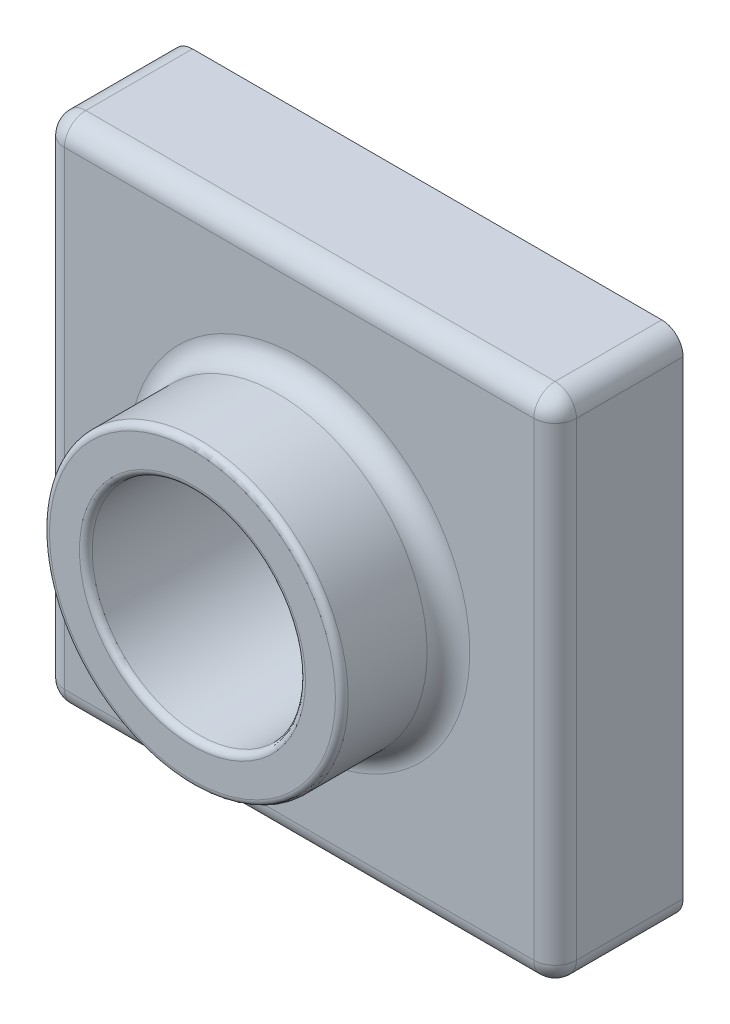
from build123d import *

# Parameters (mm, degrees)
ESQUISSE2_W             = 120
ESQUISSE2_H             = 120
BOSS_EXTRU_1_DEPTH      = 30
ESQUISSE3_R             = 35
BOSS_EXTRU_3_DEPTH      = 25
ESQUISSE9_R             = 25
ENL_V_MAT_EXTRU_1_DEPTH = 179.395627749
CONG_1_R                = 5
CONG_2_R                = 1.5
COQUE1_T                = -2


with BuildPart() as part:
    # Esquisse2 → Boss.-Extru.1 (new body)
    with BuildSketch(Plane.XY):
        with Locations((60, 60)):
            Rectangle(ESQUISSE2_W, ESQUISSE2_H)
    extrude(amount=BOSS_EXTRU_1_DEPTH)

    # Esquisse3 → Boss.-Extru.3 (add)
    with BuildSketch(Plane.XY.offset(30)):
        with Locations((60, 60)):
            Circle(ESQUISSE3_R)
    extrude(amount=BOSS_EXTRU_3_DEPTH)

    # Esquisse9 → Enlèv. mat.-Extru.1 (cut, through all)
    with BuildSketch(Plane.XY.offset(55)):
        with Locations((60, 60)):
            Circle(ESQUISSE9_R)
    extrude(amount=-ENL_V_MAT_EXTRU_1_DEPTH, mode=Mode.SUBTRACT)

    # Congé1
    cong_1_edges = [part.edges().sort_by_distance(p)[0] for p in [
        (120, 60, 30),
        (25, 60, 30),
        (60, 120, 30),
        (0, 60, 30),
        (0, 120, 15),
        (120, 120, 15),
        (120, 0, 15),
        (0, 0, 15),
        (60, 0, 30),
    ]]
    fillet(cong_1_edges, radius=CONG_1_R)

    # Congé2
    cong_2_edges = [part.edges().sort_by_distance(p)[0] for p in [
        (25, 60, 55),
        (35, 60, 55),
    ]]
    fillet(cong_2_edges, radius=CONG_2_R)

    # Coque1
    coque1_openings = [part.faces().sort_by_distance(p)[0] for p in [
        (60, 1.697056275, 0),
    ]]
    offset(amount=COQUE1_T, openings=coque1_openings, kind=Kind.INTERSECTION)


solid = part.part
